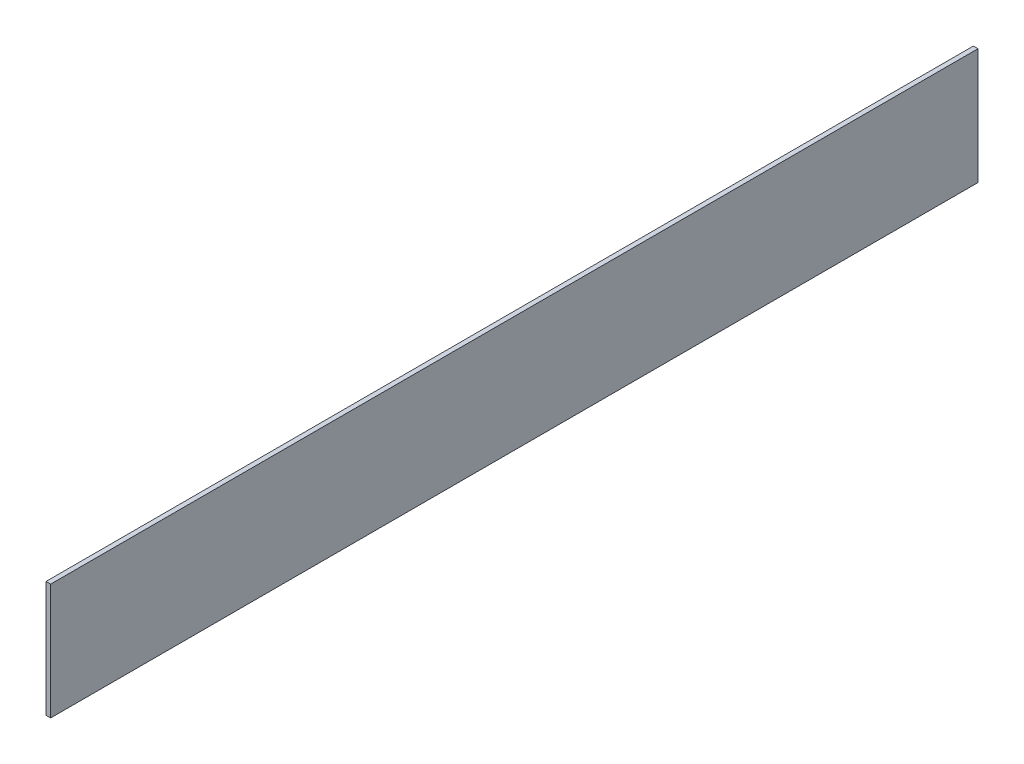
from build123d import *

# Parameters (mm, degrees)
SKETCH1_W              = 1.6
SKETCH1_H              = 40
KUTU_DUVAR_SAG_1_DEPTH = 320


with BuildPart() as part:
    # Sketch1 → KUTU_duvar_sag_1 (new body)
    with BuildSketch(Plane.XY):
        with Locations((319.2, 21.6)):
            Rectangle(SKETCH1_W, SKETCH1_H)
    extrude(amount=-KUTU_DUVAR_SAG_1_DEPTH)


solid = part.part
